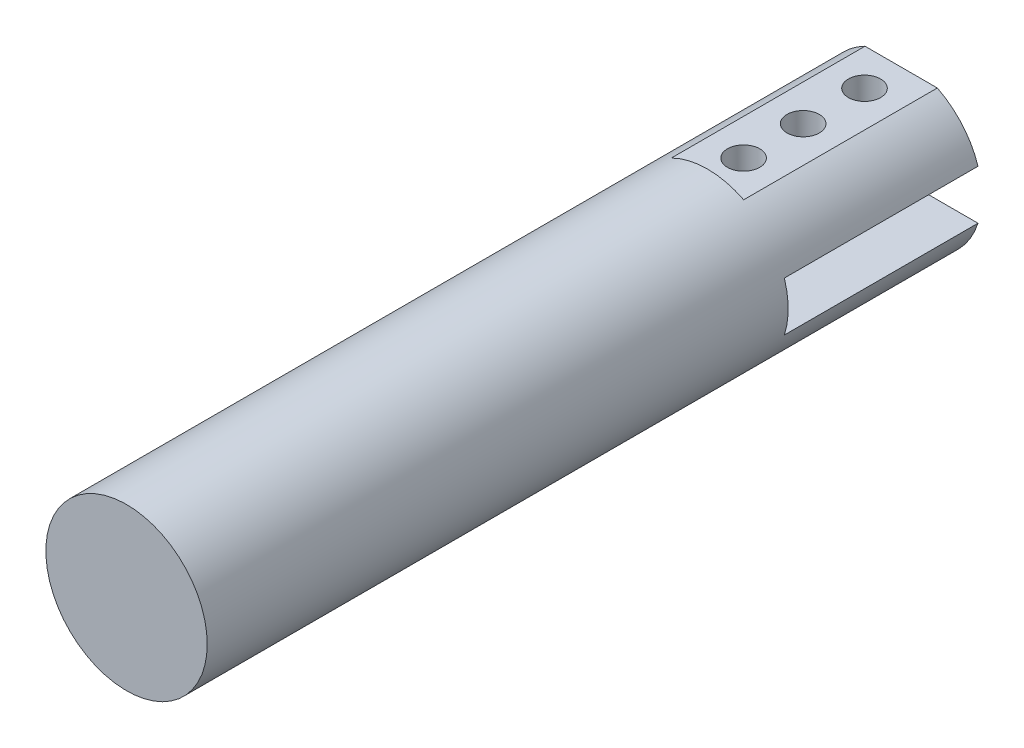
from build123d import *

# Parameters (mm, degrees)
SKETCH_1_R          = 12.5
EXTRUDE_1_DEPTH     = 120
SKETCH_2_W          = 70.200911856
SKETCH_2_H          = 7.64
CUT_EXTRUDE_2_DEPTH = 30
SKETCH_4_R          = 2.5
CUT_EXTRUDE_1_DEPTH = 35
SKETCH_5_W          = 33.79642712
SKETCH_5_H          = 6.499312907
CUT_EXTRUDE_4_DEPTH = 30


with BuildPart() as part:
    # Эскиз1 → Вытянуть1 (new body)
    with BuildSketch(Plane.XY):
        Circle(SKETCH_1_R)
    extrude(amount=EXTRUDE_1_DEPTH)

    # Эскиз2 → Вытянуть2 (cut)
    with BuildSketch(Plane(origin=(0, 0, 0), x_dir=(-1, 0, 0), z_dir=(0, 0, -1))):
        Rectangle(SKETCH_2_W, SKETCH_2_H)
    extrude(amount=-CUT_EXTRUDE_2_DEPTH, mode=Mode.SUBTRACT)

    # Эскиз4 → Вырез-Вытянуть1 (cut, symmetric)
    with BuildSketch(Plane(origin=(0, 0, 0), x_dir=(1, 0, 0), z_dir=(0, 1, 0))):
        with Locations(Location((0, -5.680597097, 0), (0, 0, 270))):
            Circle(SKETCH_4_R)
        with Locations(Location((0, -15.185844734, 0), (0, 0, 270))):
            Circle(SKETCH_4_R)
        with Locations(Location((0, -24.408758256, 0), (0, 0, 270))):
            Circle(SKETCH_4_R)
    extrude(amount=CUT_EXTRUDE_1_DEPTH, both=True, mode=Mode.SUBTRACT)

    # Эскиз5 → Вытянуть4 (cut)
    with BuildSketch(Plane(origin=(0, 0, 0), x_dir=(-1, 0, 0), z_dir=(0, 0, -1))):
        with Locations((0.724923363, -14.423475184)):
            Rectangle(SKETCH_5_W, SKETCH_5_H)
        with Locations((0.724923363, 14.423475184)):
            Rectangle(SKETCH_5_W, SKETCH_5_H)
    extrude(amount=-CUT_EXTRUDE_4_DEPTH, mode=Mode.SUBTRACT)


solid = part.part
